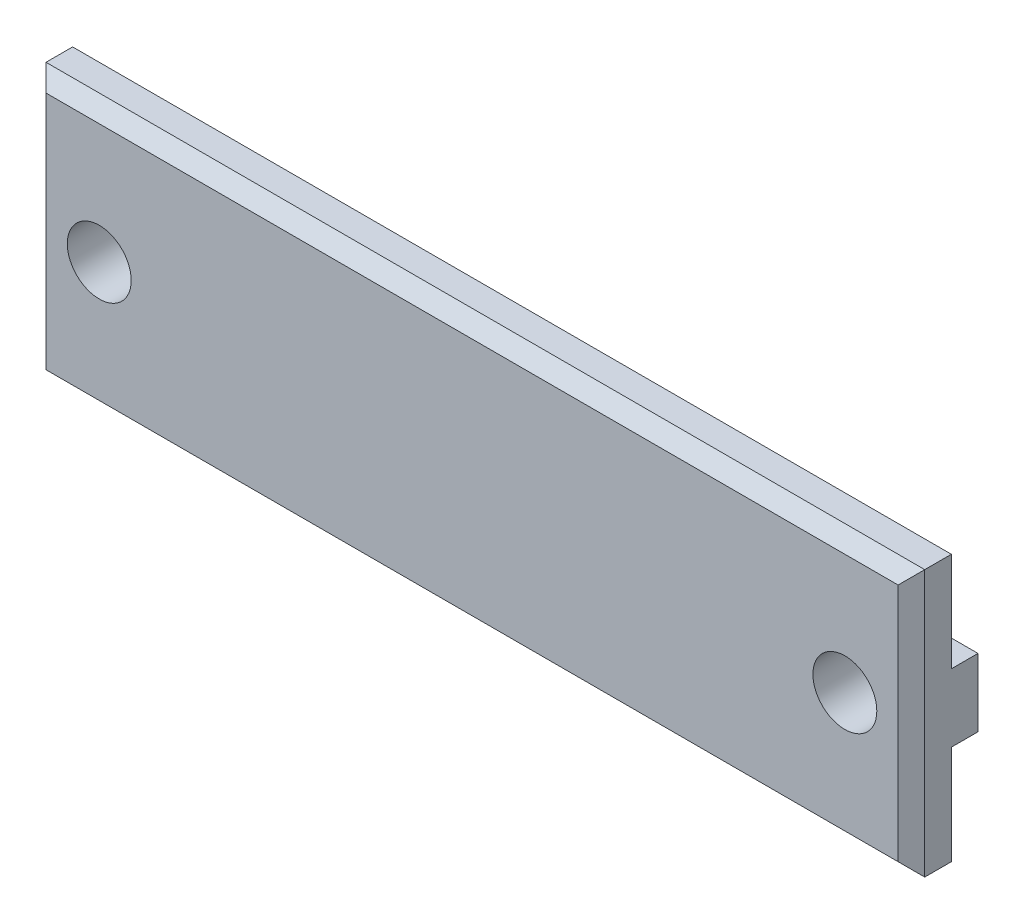
from build123d import *

# Parameters (mm, degrees)
SKETCH_1_W         = 10
SKETCH_1_H         = 5.1
EXTRUDE_1_DEPTH    = 2
EXTRUDE_1_2_DEPTH  = 2
SKETCH_2_W         = 66
SKETCH_2_H         = 20
EXTRUDE_2_DEPTH    = 3
HOLE_WIZARD_M4_1_D = 4.8
CHAMFER_1_SIZE     = 1


with BuildPart() as part:
    # 스케치1 → 보스-돌출1 (new body)
    with BuildSketch(Plane.XY):
        with Locations((28, 0)):
            Rectangle(SKETCH_1_W, SKETCH_1_H)
    extrude(amount=EXTRUDE_1_DEPTH)



with BuildPart() as body_2:
    # 스케치1 → Extrude 1 2 (new body)
    with BuildSketch(Plane.XY):
        with Locations((-28, 0)):
            Rectangle(SKETCH_1_W, SKETCH_1_H)
    extrude(amount=EXTRUDE_1_2_DEPTH)


with BuildPart() as part_1:
    add(part.part)

    add(body_2.part)  # 보스-돌출2 merges body 2
    # 스케치2 → 보스-돌출2 (add)
    with BuildSketch(Plane.XY.offset(2)):
        Rectangle(SKETCH_2_W, SKETCH_2_H)
    extrude(amount=EXTRUDE_2_DEPTH)

    # M4 여유 구멍1 (through all)
    with Locations(Plane.XY.offset(5)):
        with Locations((-28, 0), (28, 0)):
            Hole(HOLE_WIZARD_M4_1_D / 2)

    # 모따기1
    chamfer_1_edges = [part_1.edges().sort_by_distance(p)[0] for p in [
        (-33, 0, 5),
        (0, -10, 5),
        (33, 0, 5),
        (0, 10, 5),
    ]]
    chamfer(chamfer_1_edges, length=CHAMFER_1_SIZE)


solid = part_1.part
